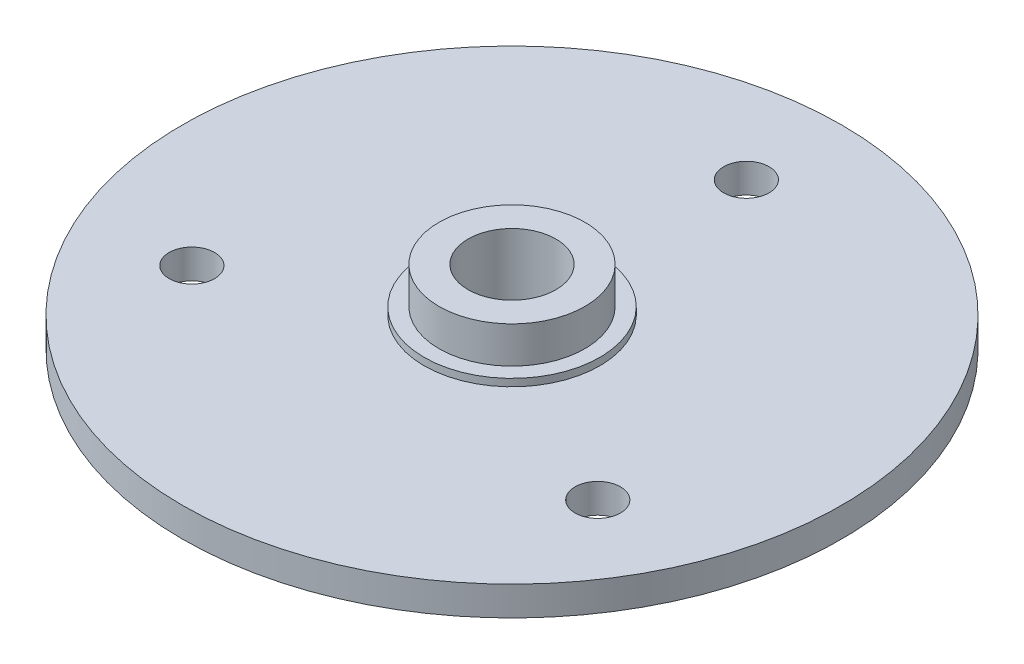
from build123d import *

# Parameters (mm, degrees)
SKETCH_1_R          = 22.5
SKETCH_1_R_2        = 1.55
EXTRUDE_1_DEPTH     = 2
SKETCH_2_R          = 4.98
EXTRUDE_2_DEPTH     = 3
SKETCH_3_R          = 6
EXTRUDE_3_DEPTH     = 0.5
SKETCH_4_R          = 3
CUT_EXTRUDE_1_DEPTH = 33.210246817


with BuildPart() as part:
    # ｽｹｯﾁ1 → ﾎﾞｽ - 押し出し1 (new body)
    with BuildSketch(Plane(origin=(0, 0, 0), x_dir=(1, 0, 0), z_dir=(0, 1, 0))):
        with Locations(Location((0, 0, 0), (0, 0, 270))):
            Circle(SKETCH_1_R)
        with Locations(Location((0, 16, 0), (0, 0, 270))):
            Circle(SKETCH_1_R_2, mode=Mode.SUBTRACT)
        with Locations(Location((13.856406461, -8, 0), (0, 0, 270))):
            Circle(SKETCH_1_R_2, mode=Mode.SUBTRACT)
        with Locations(Location((-13.856406461, -8, 0), (0, 0, 270))):
            Circle(SKETCH_1_R_2, mode=Mode.SUBTRACT)
    extrude(amount=EXTRUDE_1_DEPTH)

    # ｽｹｯﾁ2 → ﾎﾞｽ - 押し出し2 (add)
    with BuildSketch(Plane(origin=(0, 2, 0), x_dir=(1, 0, 0), z_dir=(0, 1, 0))):
        with Locations(Location((0, 0, 0), (0, 0, 270))):
            Circle(SKETCH_2_R)
    extrude(amount=EXTRUDE_2_DEPTH)

    # ｽｹｯﾁ3 → ﾎﾞｽ - 押し出し3 (add)
    with BuildSketch(Plane(origin=(0, 2, 0), x_dir=(1, 0, 0), z_dir=(0, 1, 0))):
        with Locations(Location((0, 0, 0), (0, 0, 270))):
            Circle(SKETCH_3_R)
    extrude(amount=EXTRUDE_3_DEPTH)

    # ｽｹｯﾁ4 → ｶｯﾄ - 押し出し1 (cut, through all)
    with BuildSketch(Plane(origin=(0, 5, 0), x_dir=(1, 0, 0), z_dir=(0, 1, 0))):
        with Locations(Location((0, 0, 0), (0, 0, 270))):
            Circle(SKETCH_4_R)
    extrude(amount=-CUT_EXTRUDE_1_DEPTH, mode=Mode.SUBTRACT)


solid = part.part
